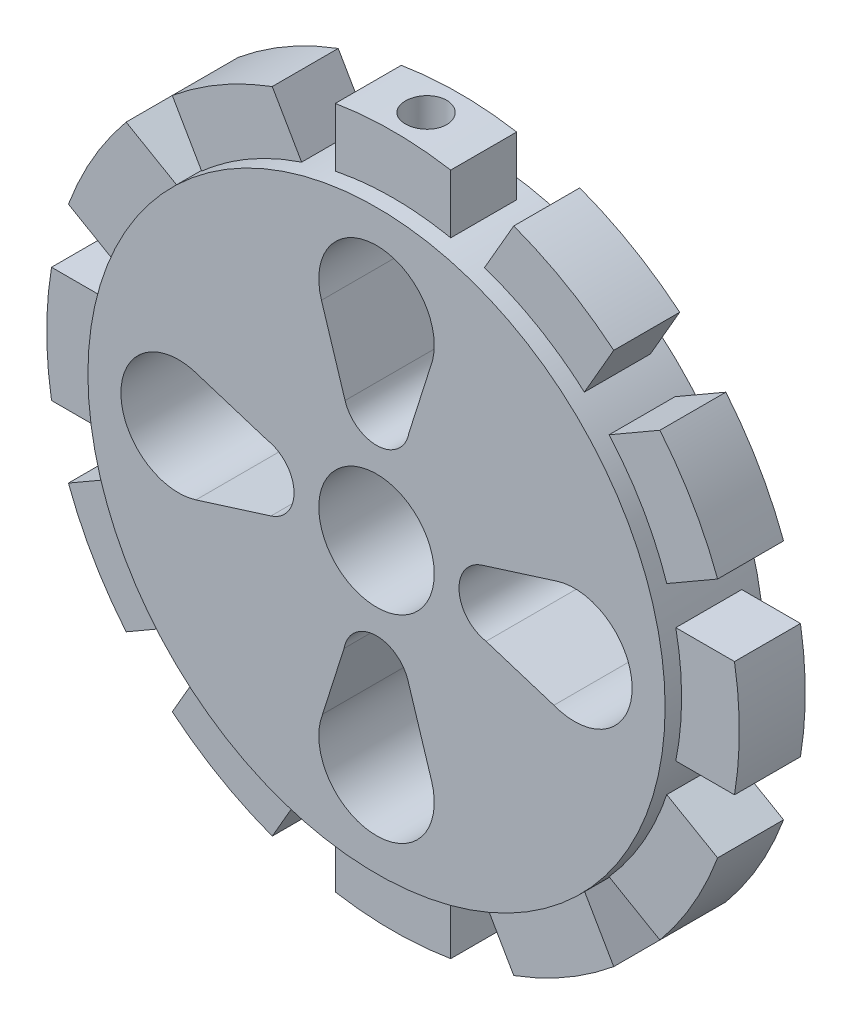
from build123d import *

# Parameters (mm, degrees)
CROQUIS1_R                 = 35
CROQUIS1_R_2               = 7
SALIENTE_EXTRUIR1_DEPTH    = 6
SALIENTE_EXTRUIR2_DEPTH    = 4
SALIENTE_EXTRUIR2_2_DEPTH  = 4
SALIENTE_EXTRUIR2_3_DEPTH  = 4
SALIENTE_EXTRUIR2_4_DEPTH  = 4
SALIENTE_EXTRUIR2_5_DEPTH  = 4
SALIENTE_EXTRUIR2_6_DEPTH  = 4
SALIENTE_EXTRUIR2_7_DEPTH  = 4
SALIENTE_EXTRUIR2_8_DEPTH  = 4
SALIENTE_EXTRUIR2_9_DEPTH  = 4
SALIENTE_EXTRUIR2_10_DEPTH = 4
SALIENTE_EXTRUIR2_11_DEPTH = 4
SALIENTE_EXTRUIR2_12_DEPTH = 4
CROQUIS7_R                 = 2.5
CORTAR_EXTRUIR3_DEPTH      = 4


with BuildPart() as part:
    # Croquis1 → Saliente-Extruir1 (new, symmetric)
    with BuildSketch(Plane.XY):
        Circle(CROQUIS1_R)
        Circle(CROQUIS1_R_2, mode=Mode.SUBTRACT)
        with BuildLine():
            Line((-6.67757441, 21.9), (-3.815756806, 12.8))
            ThreePointArc((-3.815756806, 12.8), (0.249710926, 10.007802052), (3.935549423, 13.284842156))
            Line((3.935549423, 13.284842156), (6.541207042, 21.507489131))
            ThreePointArc((6.541207042, 21.507489131), (0.207762389, 30.996916091), (-6.67757441, 21.9))
        make_face(mode=Mode.SUBTRACT)
        with BuildLine():
            Line((21.9, 6.67757441), (12.8, 3.815756806))
            ThreePointArc((12.8, 3.815756806), (10.007802052, -0.249710926), (13.284842156, -3.935549423))
            Line((13.284842156, -3.935549423), (21.507489131, -6.541207042))
            ThreePointArc((21.507489131, -6.541207042), (30.996916091, -0.207762389), (21.9, 6.67757441))
        make_face(mode=Mode.SUBTRACT)
        with BuildLine():
            Line((6.67757441, -21.9), (3.815756806, -12.8))
            ThreePointArc((3.815756806, -12.8), (-0.249710926, -10.007802052), (-3.935549423, -13.284842156))
            Line((-3.935549423, -13.284842156), (-6.541207042, -21.507489131))
            ThreePointArc((-6.541207042, -21.507489131), (-0.207762389, -30.996916091), (6.67757441, -21.9))
        make_face(mode=Mode.SUBTRACT)
        with BuildLine():
            Line((-21.9, -6.67757441), (-12.8, -3.815756806))
            ThreePointArc((-12.8, -3.815756806), (-10.007802052, 0.249710926), (-13.284842156, 3.935549423))
            Line((-13.284842156, 3.935549423), (-21.507489131, 6.541207042))
            ThreePointArc((-21.507489131, 6.541207042), (-30.996916091, 0.207762389), (-21.9, -6.67757441))
        make_face(mode=Mode.SUBTRACT)
    extrude(amount=SALIENTE_EXTRUIR1_DEPTH, both=True)


with BuildPart() as body_2:
    # Croquis4 → Saliente-Extruir2 (new, symmetric)
    with BuildSketch(Plane.XY):
        with BuildLine():
            Line((-7, 41.412558482), (-7, 34.292856399))
            ThreePointArc((-7, 34.292856399), (0, 35), (7, 34.292856399))
            Line((7, 34.292856399), (7, 41.412558482))
            ThreePointArc((7, 41.412558482), (0, 42), (-7, 41.412558482))
        make_face()
    extrude(amount=SALIENTE_EXTRUIR2_DEPTH, both=True)

    # Croquis7 → Cortar-Extruir3 (cut)
    with BuildSketch(Plane(origin=(0, 42, 0), x_dir=(1, 0, 0), z_dir=(0, 1, 0))):
        with Locations(Location((0, 0, 0), (0, 0, 270))):
            Circle(CROQUIS7_R)
    extrude(amount=-CORTAR_EXTRUIR3_DEPTH, mode=Mode.SUBTRACT)


with BuildPart() as body_3:
    # Croquis4 → Saliente-Extruir2 2 (new, symmetric)
    with BuildSketch(Plane.XY):
        with BuildLine():
            Line((14.644101414, 39.364327681), (11.084250373, 33.19848481))
            ThreePointArc((11.084250373, 33.19848481), (17.5, 30.310889132), (23.208606026, 26.19848481))
            Line((23.208606026, 26.19848481), (26.768457067, 32.364327681))
            ThreePointArc((26.768457067, 32.364327681), (21, 36.373066959), (14.644101414, 39.364327681))
        make_face()
    extrude(amount=SALIENTE_EXTRUIR2_2_DEPTH, both=True)


with BuildPart() as body_4:
    # Croquis4 → Saliente-Extruir2 3 (new, symmetric)
    with BuildSketch(Plane.XY):
        with BuildLine():
            Line((32.364327681, 26.768457067), (26.19848481, 23.208606026))
            ThreePointArc((26.19848481, 23.208606026), (30.310889132, 17.5), (33.19848481, 11.084250373))
            Line((33.19848481, 11.084250373), (39.364327681, 14.644101414))
            ThreePointArc((39.364327681, 14.644101414), (36.373066959, 21), (32.364327681, 26.768457067))
        make_face()
    extrude(amount=SALIENTE_EXTRUIR2_3_DEPTH, both=True)


with BuildPart() as body_5:
    # Croquis4 → Saliente-Extruir2 4 (new, symmetric)
    with BuildSketch(Plane.XY):
        with BuildLine():
            Line((41.412558482, 7), (34.292856399, 7))
            ThreePointArc((34.292856399, 7), (35, 0), (34.292856399, -7))
            Line((34.292856399, -7), (41.412558482, -7))
            ThreePointArc((41.412558482, -7), (42, 0), (41.412558482, 7))
        make_face()
    extrude(amount=SALIENTE_EXTRUIR2_4_DEPTH, both=True)


with BuildPart() as body_6:
    # Croquis4 → Saliente-Extruir2 5 (new, symmetric)
    with BuildSketch(Plane.XY):
        with BuildLine():
            Line((39.364327681, -14.644101414), (33.19848481, -11.084250373))
            ThreePointArc((33.19848481, -11.084250373), (30.310889132, -17.5), (26.19848481, -23.208606026))
            Line((26.19848481, -23.208606026), (32.364327681, -26.768457067))
            ThreePointArc((32.364327681, -26.768457067), (36.373066959, -21), (39.364327681, -14.644101414))
        make_face()
    extrude(amount=SALIENTE_EXTRUIR2_5_DEPTH, both=True)


with BuildPart() as body_7:
    # Croquis4 → Saliente-Extruir2 6 (new, symmetric)
    with BuildSketch(Plane.XY):
        with BuildLine():
            Line((26.768457067, -32.364327681), (23.208606026, -26.19848481))
            ThreePointArc((23.208606026, -26.19848481), (17.5, -30.310889132), (11.084250373, -33.19848481))
            Line((11.084250373, -33.19848481), (14.644101414, -39.364327681))
            ThreePointArc((14.644101414, -39.364327681), (21, -36.373066959), (26.768457067, -32.364327681))
        make_face()
    extrude(amount=SALIENTE_EXTRUIR2_6_DEPTH, both=True)


with BuildPart() as body_8:
    # Croquis4 → Saliente-Extruir2 7 (new, symmetric)
    with BuildSketch(Plane.XY):
        with BuildLine():
            Line((7, -41.412558482), (7, -34.292856399))
            ThreePointArc((7, -34.292856399), (0, -35), (-7, -34.292856399))
            Line((-7, -34.292856399), (-7, -41.412558482))
            ThreePointArc((-7, -41.412558482), (0, -42), (7, -41.412558482))
        make_face()
    extrude(amount=SALIENTE_EXTRUIR2_7_DEPTH, both=True)


with BuildPart() as body_9:
    # Croquis4 → Saliente-Extruir2 8 (new, symmetric)
    with BuildSketch(Plane.XY):
        with BuildLine():
            Line((-14.644101414, -39.364327681), (-11.084250373, -33.19848481))
            ThreePointArc((-11.084250373, -33.19848481), (-17.5, -30.310889132), (-23.208606026, -26.19848481))
            Line((-23.208606026, -26.19848481), (-26.768457067, -32.364327681))
            ThreePointArc((-26.768457067, -32.364327681), (-21, -36.373066959), (-14.644101414, -39.364327681))
        make_face()
    extrude(amount=SALIENTE_EXTRUIR2_8_DEPTH, both=True)


with BuildPart() as body_10:
    # Croquis4 → Saliente-Extruir2 9 (new, symmetric)
    with BuildSketch(Plane.XY):
        with BuildLine():
            Line((-32.364327681, -26.768457067), (-26.19848481, -23.208606026))
            ThreePointArc((-26.19848481, -23.208606026), (-30.310889132, -17.5), (-33.19848481, -11.084250373))
            Line((-33.19848481, -11.084250373), (-39.364327681, -14.644101414))
            ThreePointArc((-39.364327681, -14.644101414), (-36.373066959, -21), (-32.364327681, -26.768457067))
        make_face()
    extrude(amount=SALIENTE_EXTRUIR2_9_DEPTH, both=True)


with BuildPart() as body_11:
    # Croquis4 → Saliente-Extruir2 10 (new, symmetric)
    with BuildSketch(Plane.XY):
        with BuildLine():
            Line((-41.412558482, -7), (-34.292856399, -7))
            ThreePointArc((-34.292856399, -7), (-35, 0), (-34.292856399, 7))
            Line((-34.292856399, 7), (-41.412558482, 7))
            ThreePointArc((-41.412558482, 7), (-42, 0), (-41.412558482, -7))
        make_face()
    extrude(amount=SALIENTE_EXTRUIR2_10_DEPTH, both=True)


with BuildPart() as body_12:
    # Croquis4 → Saliente-Extruir2 11 (new, symmetric)
    with BuildSketch(Plane.XY):
        with BuildLine():
            Line((-39.364327681, 14.644101414), (-33.19848481, 11.084250373))
            ThreePointArc((-33.19848481, 11.084250373), (-30.310889132, 17.5), (-26.19848481, 23.208606026))
            Line((-26.19848481, 23.208606026), (-32.364327681, 26.768457067))
            ThreePointArc((-32.364327681, 26.768457067), (-36.373066959, 21), (-39.364327681, 14.644101414))
        make_face()
    extrude(amount=SALIENTE_EXTRUIR2_11_DEPTH, both=True)


with BuildPart() as body_13:
    # Croquis4 → Saliente-Extruir2 12 (new, symmetric)
    with BuildSketch(Plane.XY):
        with BuildLine():
            Line((-26.768457067, 32.364327681), (-23.208606026, 26.19848481))
            ThreePointArc((-23.208606026, 26.19848481), (-17.5, 30.310889132), (-11.084250373, 33.19848481))
            Line((-11.084250373, 33.19848481), (-14.644101414, 39.364327681))
            ThreePointArc((-14.644101414, 39.364327681), (-21, 36.373066959), (-26.768457067, 32.364327681))
        make_face()
    extrude(amount=SALIENTE_EXTRUIR2_12_DEPTH, both=True)


solid = Compound([part.part, body_2.part, body_3.part, body_4.part, body_5.part, body_6.part, body_7.part, body_8.part, body_9.part, body_10.part, body_11.part, body_12.part, body_13.part])
